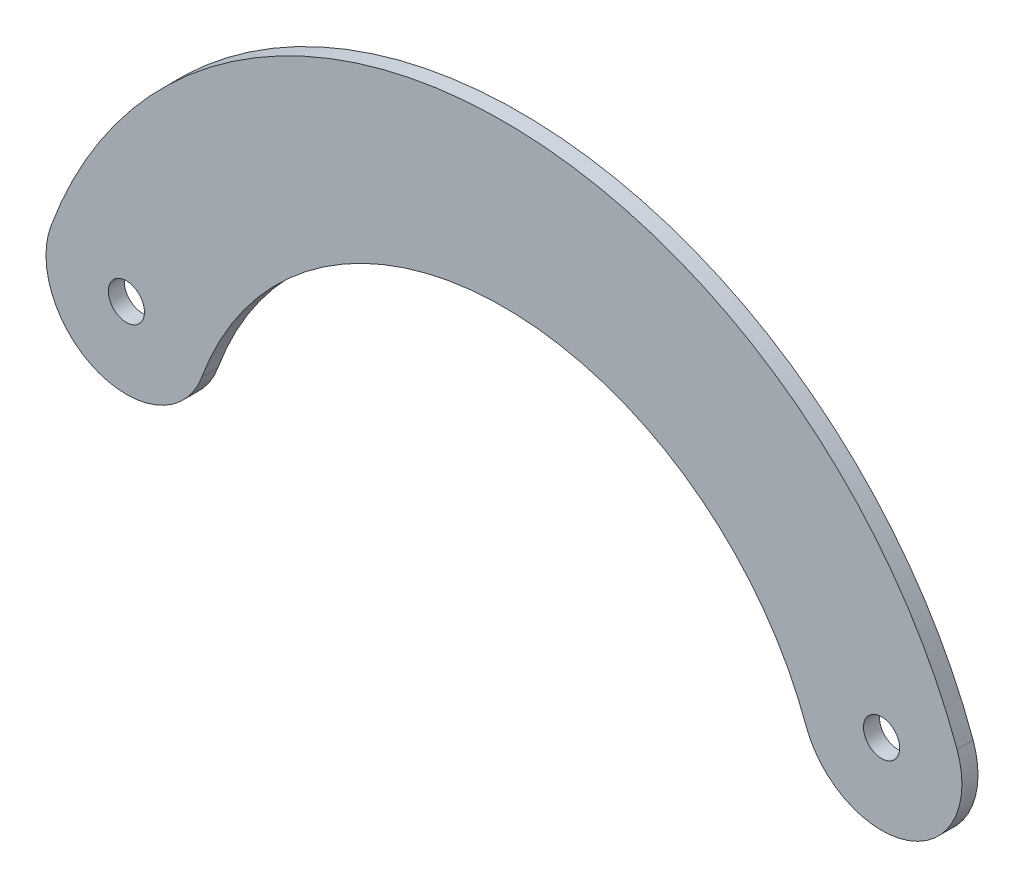
from build123d import *

# Parameters (mm, degrees)
ESQUISSE1_R        = 2.25
BOSS_EXTRU_1_DEPTH = 2


with BuildPart() as part:
    # Esquisse1 → Boss.-Extru.1 (new body)
    with BuildSketch(Plane.XY):
        with BuildLine():
            ThreePointArc((37.587704831, 13.680805733), (50.404832473, 7.704080958), (56.381557247, 20.5212086))
            ThreePointArc((56.381557247, 20.5212086), (0, 60), (-56.381557247, 20.5212086))
            ThreePointArc((-56.381557247, 20.5212086), (-50.404832473, 7.704080958), (-37.587704831, 13.680805733))
            ThreePointArc((-37.587704831, 13.680805733), (0, 40), (37.587704831, 13.680805733))
        make_face()
        with Locations((-46.984631039, 17.101007166)):
            Circle(ESQUISSE1_R, mode=Mode.SUBTRACT)
        with Locations((46.984631039, 17.101007166)):
            Circle(ESQUISSE1_R, mode=Mode.SUBTRACT)
    extrude(amount=BOSS_EXTRU_1_DEPTH)


solid = part.part
